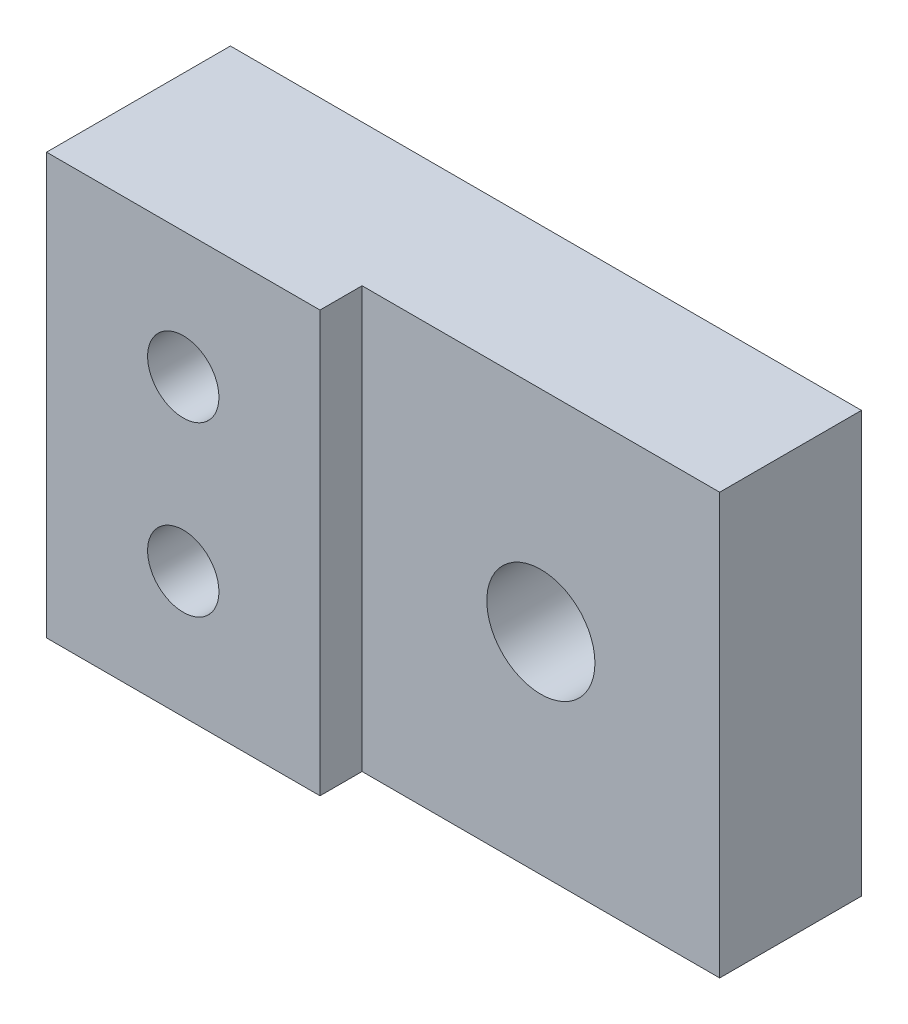
from build123d import *

# Parameters (mm, degrees)
SKETCH1_W           = 16.51
SKETCH1_H           = 25.4
SKETCH1_R           = 2.15265
BOSS_EXTRUDE1_DEPTH = 11.0998
SKETCH1_3_W         = 21.59
SKETCH1_3_H         = 25.4
SKETCH1_3_R         = 3.2639
BOSS_EXTRUDE2_DEPTH = 8.5598


with BuildPart() as part:
    # Sketch1 → Boss-Extrude1 (new body)
    with BuildSketch(Plane.XY):
        with Locations((7.447427401, 13.4112)):
            Rectangle(SKETCH1_W, SKETCH1_H)
        with Locations((7.447427401, 8.3312)):
            Circle(SKETCH1_R, mode=Mode.SUBTRACT)
        with Locations((7.447427401, 18.4912)):
            Circle(SKETCH1_R, mode=Mode.SUBTRACT)
    extrude(amount=BOSS_EXTRUDE1_DEPTH)

    # Sketch1<3> → Boss-Extrude2 (add)
    with BuildSketch(Plane.XY):
        with Locations((26.497427401, 13.4112)):
            Rectangle(SKETCH1_3_W, SKETCH1_3_H)
        with Locations((26.497427401, 13.4112)):
            Circle(SKETCH1_3_R, mode=Mode.SUBTRACT)
    extrude(amount=BOSS_EXTRUDE2_DEPTH)


solid = part.part
